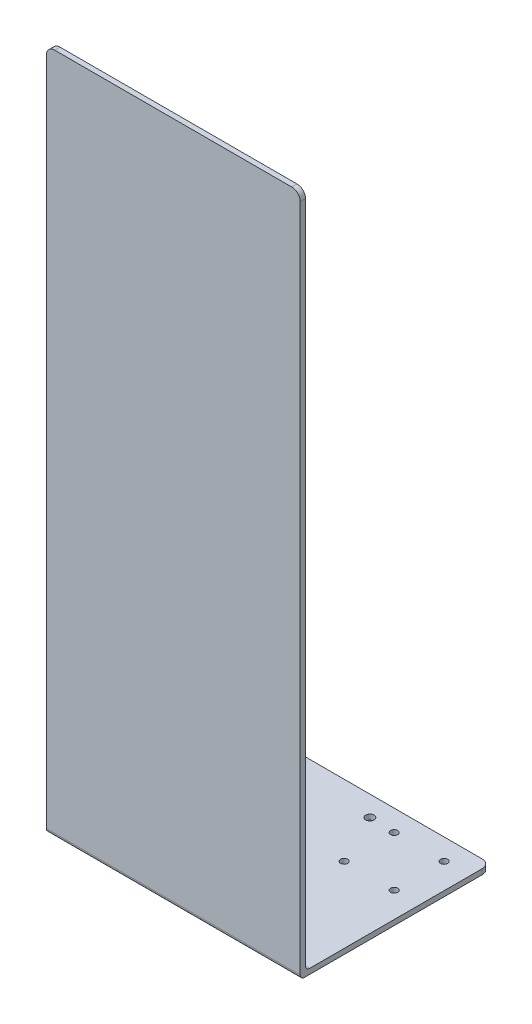
from build123d import *

# Parameters (mm, degrees)
SKETCH1_W           = 152.4
SKETCH1_H           = 114.3
BOSS_EXTRUDE1_DEPTH = 3.175
SKETCH2_W           = 152.4
SKETCH2_H           = 3.175
BOSS_EXTRUDE2_DEPTH = 406.4
FILLET1_R           = 2.54
FILLET2_R           = 5.08
SKETCH3_R           = 30.988
SKETCH3_R_2         = 2.54
SKETCH3_R_3         = 2.159
SKETCH3_R_4         = 2.15
CUT_EXTRUDE1_DEPTH  = 418.41289211


with BuildPart() as part:
    # Sketch1 → Boss-Extrude1 (new body)
    with BuildSketch(Plane(origin=(0, 0, 0), x_dir=(1, 0, 0), z_dir=(0, 1, 0))):
        Rectangle(SKETCH1_W, SKETCH1_H)
    extrude(amount=BOSS_EXTRUDE1_DEPTH)

    # Sketch2 → Boss-Extrude2 (add)
    with BuildSketch(Plane(origin=(0, 3.175, 0), x_dir=(1, 0, 0), z_dir=(0, 1, 0))):
        with Locations((0, -55.5625)):
            Rectangle(SKETCH2_W, SKETCH2_H)
    extrude(amount=BOSS_EXTRUDE2_DEPTH)

    # Fillet1
    fillet1_edges = [part.edges().sort_by_distance(p)[0] for p in [
        (0, 3.175, 53.975),
        (0, 0, 57.15),
    ]]
    fillet(fillet1_edges, radius=FILLET1_R)

    # Fillet2
    fillet2_edges = [part.edges().sort_by_distance(p)[0] for p in [
        (-76.2, 409.575, 55.5625),
        (76.2, 409.575, 55.5625),
        (-76.2, 1.5875, -57.15),
        (76.2, 1.5875, -57.15),
    ]]
    fillet(fillet2_edges, radius=FILLET2_R)

    # Sketch3 → Cut-Extrude1 (cut, through all)
    with BuildSketch(Plane(origin=(0, 3.175, 0), x_dir=(1, 0, 0), z_dir=(0, 1, 0))):
        with Locations(Location((-25.4, 3.81, 0), (0, 0, 270))):
            Circle(SKETCH3_R)
        with Locations(Location((15.875, 44.958, 0), (0, 0, 270))):
            Circle(SKETCH3_R_2)
        with Locations(Location((-66.675, -37.465, 0), (0, 0, 270))):
            Circle(SKETCH3_R_2)
        with Locations(Location((15.875, -37.465, 0), (0, 0, 270))):
            Circle(SKETCH3_R_2)
        with Locations(Location((30.988, 44.45, 0), (0, 0, 270))):
            Circle(SKETCH3_R_3)
        with Locations(Location((60.93860251, 44.46, 0), (0, 0, 270))):
            Circle(SKETCH3_R_4)
        with Locations(Location((60.96, 14.478, 0), (0, 0, 270))):
            Circle(SKETCH3_R_3)
        with Locations(Location((30.93860251, 14.478, 0), (0, 0, 270))):
            Circle(SKETCH3_R_3)
        with Locations(Location((-66.675, 45.085, 0), (0, 0, 270))):
            Circle(SKETCH3_R_2)
    extrude(amount=-CUT_EXTRUDE1_DEPTH, mode=Mode.SUBTRACT)


solid = part.part
